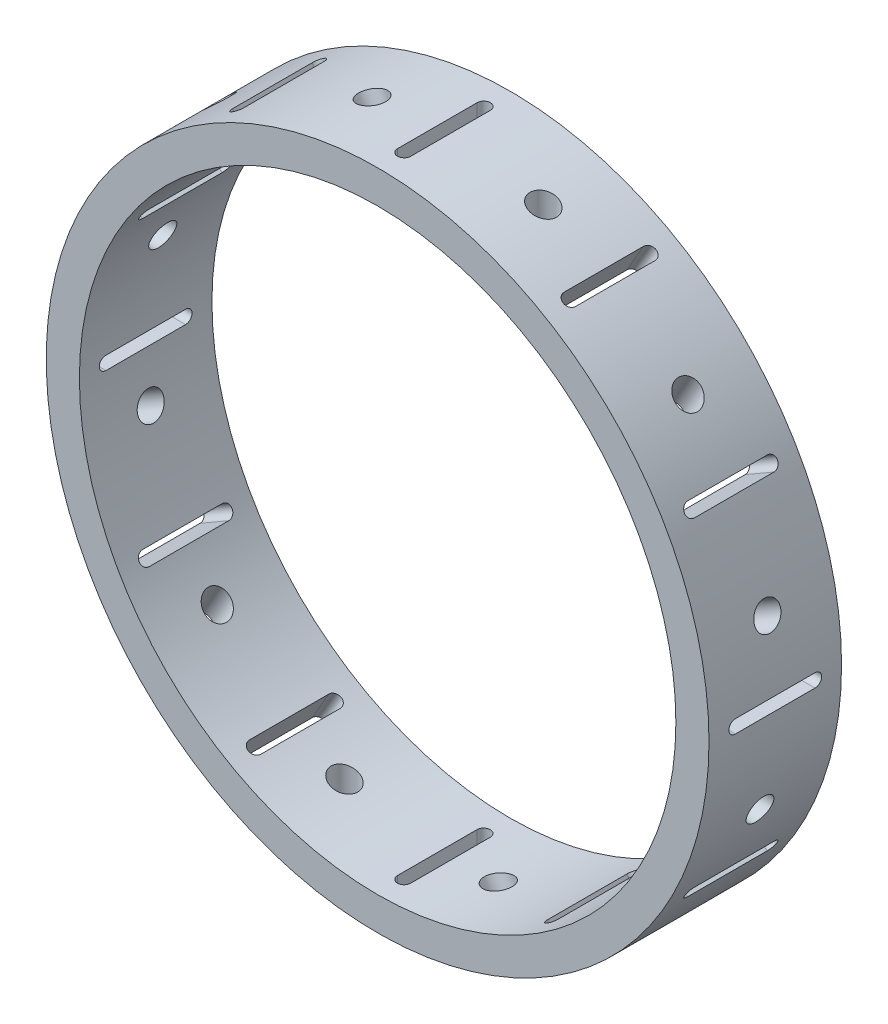
from build123d import *

# Parameters (mm, degrees)
SKETCH1_R           = 50
BOSS_EXTRUDE1_DEPTH = 10
SKETCH2_R           = 45
CUT_EXTRUDE1_DEPTH  = 20
CUT_EXTRUDE3_DEPTH  = 20
SKETCH6_R           = 2
CUT_EXTRUDE5_DEPTH  = 20
CIRPATTERN3_COUNT   = 12


with BuildPart() as part:
    # Sketch1 → Boss-Extrude1 (new, symmetric)
    with BuildSketch(Plane.XY):
        Circle(SKETCH1_R)
    extrude(amount=BOSS_EXTRUDE1_DEPTH, both=True)

    # Sketch2 → Cut-Extrude1 (cut)
    with BuildSketch(Plane.XY.offset(10)):
        Circle(SKETCH2_R)
    extrude(amount=-CUT_EXTRUDE1_DEPTH, mode=Mode.SUBTRACT)

    # Sketch4 → Cut-Extrude3 (cut)
    with BuildSketch(Plane(origin=(0, 50, 0), x_dir=(1, 0, 0), z_dir=(0, 1, 0))):
        with BuildLine():
            Line((1, 6), (1, -6))
            ThreePointArc((1, -6), (0, -7), (-1, -6))
            Line((-1, -6), (-1, 6))
            ThreePointArc((-1, 6), (0, 7), (1, 6))
        make_face()
    cut_extrude3 = extrude(amount=-CUT_EXTRUDE3_DEPTH, mode=Mode.SUBTRACT)

    # Sketch6 → Cut-Extrude5 (cut)
    with BuildSketch(Plane(origin=(0, 50, 0), x_dir=(1, 0, 0), z_dir=(0, 1, 0))):
        with Locations(Location((15, 0, 0), (0, 0, 270))):
            Circle(SKETCH6_R)
    cut_extrude5 = extrude(amount=-CUT_EXTRUDE5_DEPTH, mode=Mode.SUBTRACT)

    # CirPattern3: Cut-Extrude3, Cut-Extrude5 ×12 about axis
    cirpattern3_axis = Axis((0, 0, 0), (0, 0, 1))
    add([cut_extrude3.rotate(cirpattern3_axis, i * 360 / CIRPATTERN3_COUNT) for i in range(1, CIRPATTERN3_COUNT)], mode=Mode.SUBTRACT)
    add([cut_extrude5.rotate(cirpattern3_axis, i * 360 / CIRPATTERN3_COUNT) for i in range(1, CIRPATTERN3_COUNT)], mode=Mode.SUBTRACT)


solid = part.part
